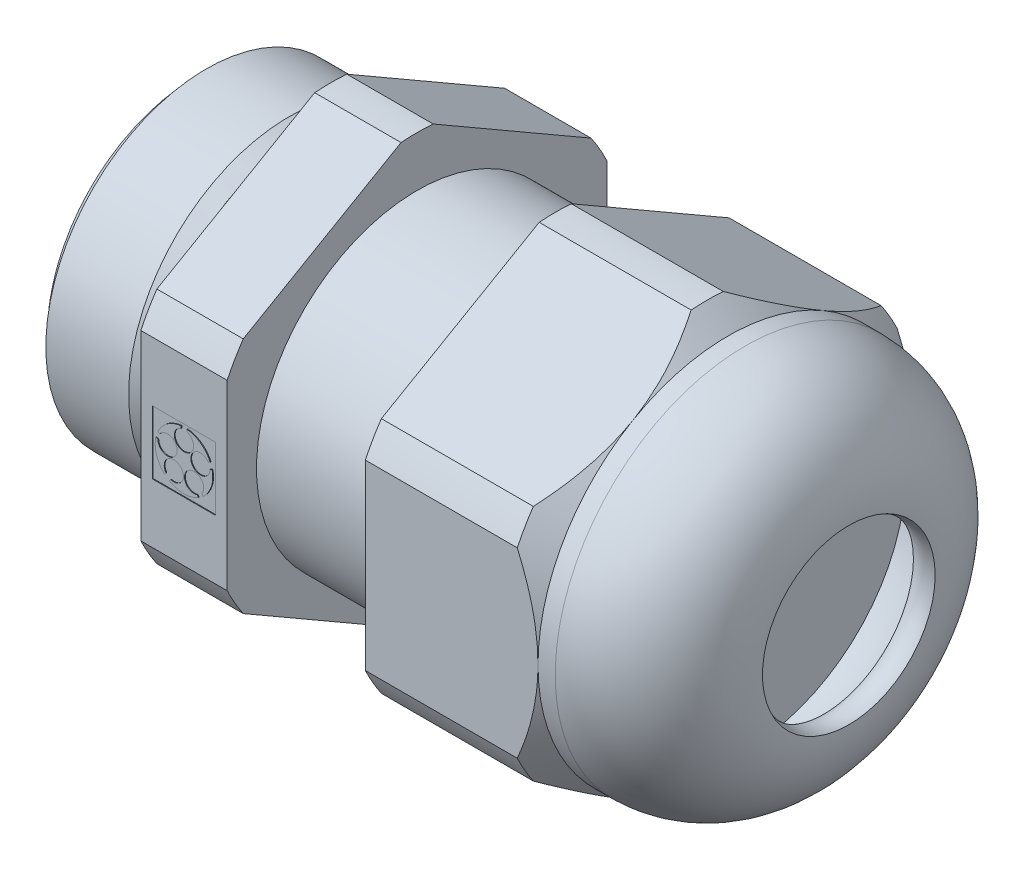
from build123d import *

# Parameters (mm, degrees)
ESQUISSE2_W             = 44
ESQUISSE2_H             = 44
ENL_V_MAT_EXTRU_1_DEPTH = 38
ESQUISSE3_W             = 3.666666666
ESQUISSE3_H             = 3.666666666
ENL_V_MAT_EXTRU_2_DEPTH = 0.044


with BuildPart() as part:
    # Esquisse1 → Révolution1 (revolve)
    with BuildSketch(Plane.XY, mode=Mode.PRIVATE) as r_volution1_sk:
        with BuildLine():
            Line((0, 8.105), (0, 2.73))
            ThreePointArc((0, 2.73), (0.21381205, 2.21381205), (0.73, 2))
            Line((0.73, 2), (32, 2))
            Line((32, 2), (32, 9.3))
            ThreePointArc((32, 9.3), (34.7551415, 8.301392936), (36.23060683, 5.76939317))
            ThreePointArc((36.23060683, 5.76939317), (36.921370264, 4.938703552), (38, 5))
            ThreePointArc((38, 5), (36.242640687, 9.242640687), (32, 11))
            Line((32, 11), (31, 11))
            Line((31, 11), (27.333333333, 14.666666667))
            Line((27.333333333, 14.666666667), (21, 14.666666667))
            Line((21, 14.666666667), (21, 9.3))
            Line((21, 9.3), (13, 9.3))
            Line((13, 9.3), (13, 14.666666667))
            Line((13, 14.666666667), (8, 14.666666667))
            Line((8, 14.666666667), (8, 8.835))
            Line((8, 8.835), (6.4, 8.835))
            Line((6.4, 8.835), (5.594596374, 9.3))
            Line((5.594596374, 9.3), (0.8, 9.3))
            Line((0.8, 9.3), (0.8, 8.835))
            Line((0.8, 8.835), (0.73, 8.835))
            ThreePointArc((0.73, 8.835), (0.21381205, 8.62118795), (0, 8.105))
        make_face()
    revolve(r_volution1_sk.sketch.rotate(Axis((38, 0, 0), (-1, 0, 0)), 90), axis=Axis((38, 0, 0), (-1, 0, 0)))

    # Esquisse2 → Enlèv. mat.-Extru.1 (cut)
    with BuildSketch(Plane(origin=(8, 0, 0), x_dir=(0, 0, -1), z_dir=(1, 0, 0))):
        Rectangle(ESQUISSE2_W, ESQUISSE2_H)
        with BuildLine():
            Line((-11, 5.276362383), (-11, -5.276362383))
            ThreePointArc((-11, -5.276362383), (-10.565509926, -6.1), (-10.069463864, -6.88809825))
            Line((-10.069463864, -6.88809825), (-0.930536136, -12.164460633))
            ThreePointArc((-0.930536136, -12.164460633), (0, -12.2), (0.930536136, -12.164460633))
            Line((0.930536136, -12.164460633), (10.069463864, -6.88809825))
            ThreePointArc((10.069463864, -6.88809825), (10.565509926, -6.1), (11, -5.276362383))
            Line((11, -5.276362383), (11, 5.276362383))
            ThreePointArc((11, 5.276362383), (10.565509926, 6.1), (10.069463864, 6.88809825))
            Line((10.069463864, 6.88809825), (0.930536136, 12.164460633))
            ThreePointArc((0.930536136, 12.164460633), (0, 12.2), (-0.930536136, 12.164460633))
            Line((-0.930536136, 12.164460633), (-10.069463864, 6.88809825))
            ThreePointArc((-10.069463864, 6.88809825), (-10.565509926, 6.1), (-11, 5.276362383))
        make_face(mode=Mode.SUBTRACT)
    extrude(amount=ENL_V_MAT_EXTRU_1_DEPTH, mode=Mode.SUBTRACT)

    # Esquisse3 → Enlèv. mat.-Extru.2 (cut)
    with BuildSketch(Plane.XY.offset(11)):
        with Locations((10.5, 0)):
            Rectangle(ESQUISSE3_W, ESQUISSE3_H)
        with BuildLine():
            Line((9.390432265, -1.243638701), (9.465872252, -1.139804467))
            ThreePointArc((9.465872252, -1.139804467), (10.23876211, -0.359563109), (9.735544583, -1.335732884))
            Line((9.735544583, -1.335732884), (9.660104596, -1.439567118))
            ThreePointArc((9.660104596, -1.439567118), (10.5, -1.666666667), (11.339895404, -1.439567118))
            Line((11.339895404, -1.439567118), (11.264455417, -1.335732884))
            ThreePointArc((11.264455417, -1.335732884), (10.76123789, -0.359563109), (11.534127748, -1.139804467))
            Line((11.534127748, -1.139804467), (11.609567735, -1.243638701))
            ThreePointArc((11.609567735, -1.243638701), (12.085094194, -0.515028324), (12.128651642, 0.353937293))
            Line((12.128651642, 0.353937293), (12.006587179, 0.314276144))
            ThreePointArc((12.006587179, 0.314276144), (10.922691785, 0.137340886), (11.903581514, 0.631294983))
            Line((11.903581514, 0.631294983), (12.025645977, 0.670956131))
            ThreePointArc((12.025645977, 0.670956131), (11.479642087, 1.348361657), (10.666666667, 1.658312395))
            Line((10.666666667, 1.658312395), (10.666666667, 1.529966223))
            ThreePointArc((10.666666667, 1.529966223), (10.5, 0.444444444), (10.333333333, 1.529966223))
            Line((10.333333333, 1.529966223), (10.333333333, 1.658312395))
            ThreePointArc((10.333333333, 1.658312395), (9.520357913, 1.348361657), (8.974354023, 0.670956131))
            Line((8.974354023, 0.670956131), (9.096418486, 0.631294983))
            ThreePointArc((9.096418486, 0.631294983), (10.077308215, 0.137340886), (8.993412821, 0.314276144))
            Line((8.993412821, 0.314276144), (8.871348358, 0.353937293))
            ThreePointArc((8.871348358, 0.353937293), (8.914905806, -0.515028324), (9.390432265, -1.243638701))
        make_face(mode=Mode.SUBTRACT)
    extrude(amount=-ENL_V_MAT_EXTRU_2_DEPTH, mode=Mode.SUBTRACT)


solid = part.part
